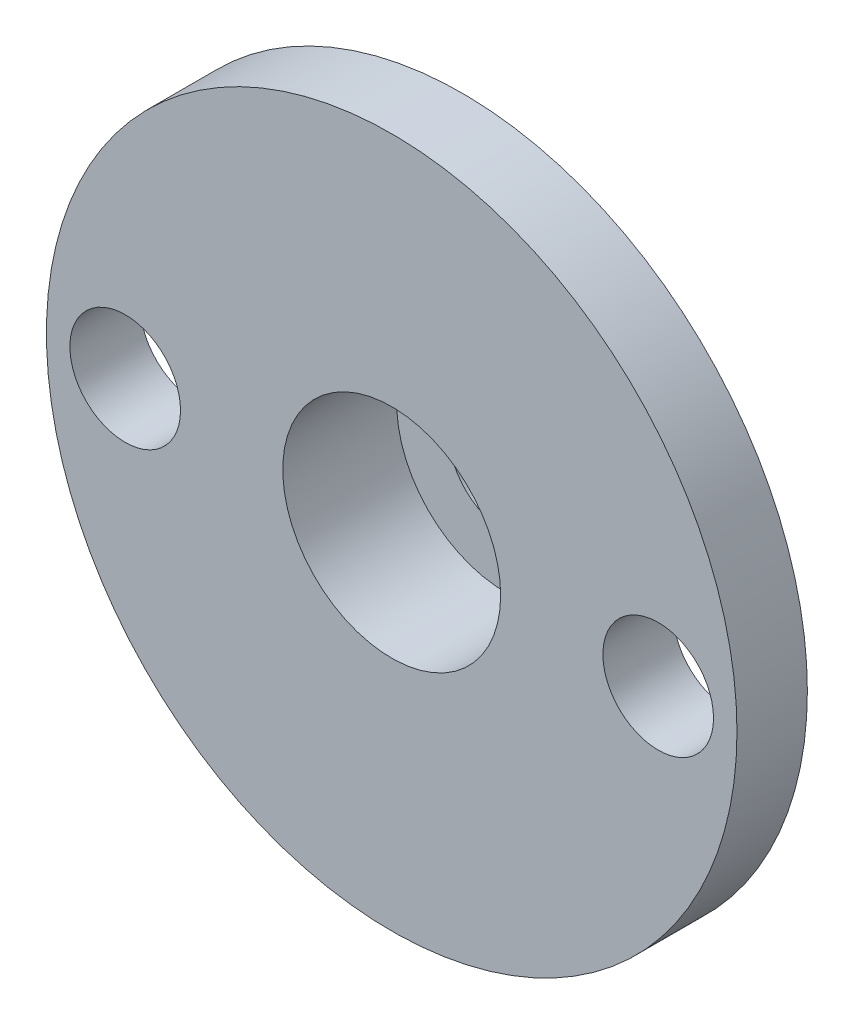
from build123d import *

# Parameters (mm, degrees)
ESQUISSE1_R             = 10.3
BOSS_EXTRU_1_DEPTH      = 2.1
ESQUISSE2_R             = 4.8
BOSS_EXTRU_2_DEPTH      = 3.3
ESQUISSE3_R             = 1.65
ENL_V_MAT_EXTRU_1_DEPTH = 16.535121499


with BuildPart() as part:
    # Esquisse1 → Boss.-Extru.1 (new body)
    with BuildSketch(Plane.XY):
        Circle(ESQUISSE1_R)
    extrude(amount=BOSS_EXTRU_1_DEPTH)

    # Esquisse2 → Boss.-Extru.2 (add)
    with BuildSketch(Plane.XY):
        Circle(ESQUISSE2_R)
    extrude(amount=-BOSS_EXTRU_2_DEPTH)

    # Esquisse3 → Enlèv. mat.-Extru.1 (cut, through all)
    with BuildSketch(Plane.XY.offset(2.1)):
        with Locations((7.95, 0)):
            Circle(ESQUISSE3_R)
        with Locations((-7.95, 0)):
            Circle(ESQUISSE3_R)
    extrude(amount=-ENL_V_MAT_EXTRU_1_DEPTH, mode=Mode.SUBTRACT)

    # Esquisse4 → Chambrage pour vis à six pans creux M31 (revolve, cut)
    with BuildSketch(Plane(origin=(0, 0, 2.1), x_dir=(0, -1, 0), z_dir=(1, 0, 0))):
        Polygon((0, 0), (0, 5.4), (1.7, 5.4), (1.7, 3.4), (3.25, 3.4), (3.25, 0), align=None)
    revolve(axis=Axis((0, 0, 8.45), (0, 0, -1)), mode=Mode.SUBTRACT)


solid = part.part
